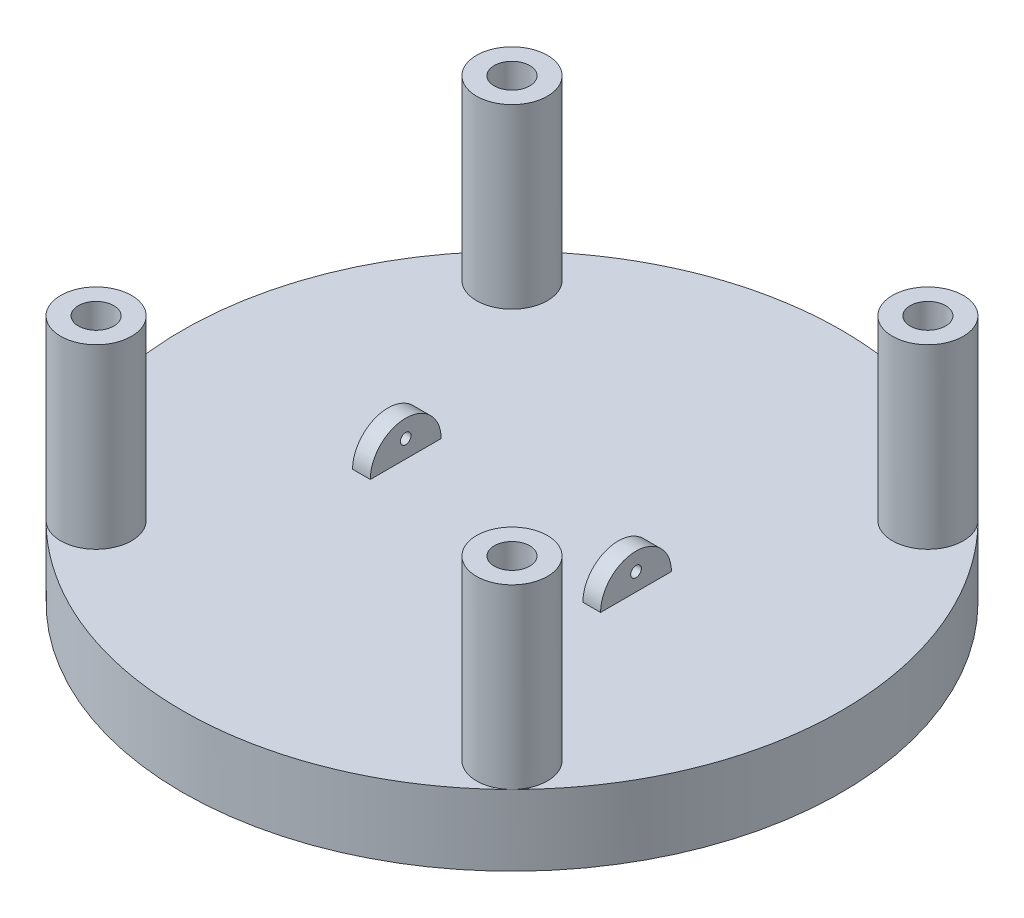
from build123d import *

# Parameters (mm, degrees)
SKETCH1_R           = 93
BOSS_EXTRUDE1_DEPTH = 20
SHELL1_T            = -3
SKETCH2_W           = 5
SKETCH2_H           = 10
REVOLVE1_ANGLE      = 180
SKETCH7_R           = 1.5
CUT_EXTRUDE1_DEPTH  = 10
SKETCH8_W           = 40
SKETCH8_H           = 40
CUT_EXTRUDE2_DEPTH  = 2
SKETCH9_R           = 10
BOSS_EXTRUDE2_DEPTH = 50
SKETCH10_R          = 5
CUT_EXTRUDE3_DEPTH  = 20
CIRPATTERN1_COUNT   = 4


with BuildPart() as part:
    # Sketch1 → Boss-Extrude1 (new body)
    with BuildSketch(Plane(origin=(0, 0, 0), x_dir=(1, 0, 0), z_dir=(0, 1, 0))):
        with Locations(Location((0, 0, 0), (0, 0, 270))):
            Circle(SKETCH1_R)
    extrude(amount=BOSS_EXTRUDE1_DEPTH)

    # Shell1
    shell1_openings = [part.faces().sort_by_distance(p)[0] for p in [
        (0, 0, 0),
    ]]
    offset(amount=SHELL1_T, openings=shell1_openings, kind=Kind.INTERSECTION)

    # Sketch2 → Revolve1 (revolve)
    with BuildSketch(Plane(origin=(0, 20, 0), x_dir=(1, 0, 0), z_dir=(0, 1, 0))):
        with Locations((-32.5, 5)):
            Rectangle(SKETCH2_W, SKETCH2_H)
    revolve1 = revolve(axis=Axis((0, 20, 0), (1, 0, 0)), revolution_arc=REVOLVE1_ANGLE)

    # Sketch7 → Cut-Extrude1 (cut)
    with BuildSketch(Plane.ZY.offset(35)):
        with Locations((0, 25)):
            Circle(SKETCH7_R)
    cut_extrude1 = extrude(amount=-CUT_EXTRUDE1_DEPTH, mode=Mode.SUBTRACT)

    # Mirror1: Revolve1, Cut-Extrude1 across plane
    add(revolve1.mirror(Plane(origin=(0, 0, 0), x_dir=(0, 0, 1), z_dir=(1, 0, 0))))
    add(cut_extrude1.mirror(Plane(origin=(0, 0, 0), x_dir=(0, 0, 1), z_dir=(1, 0, 0))), mode=Mode.SUBTRACT)

    # Sketch8 → Cut-Extrude2 (cut)
    with BuildSketch(Plane.XZ.offset(-17)):
        with Locations((0, 60)):
            Rectangle(SKETCH8_W, SKETCH8_H)
    cut_extrude2 = extrude(amount=-CUT_EXTRUDE2_DEPTH, mode=Mode.SUBTRACT)

    # Mirror2: Cut-Extrude2 across plane
    add(cut_extrude2.mirror(Plane.XY), mode=Mode.SUBTRACT)

    # Sketch9 → Boss-Extrude2 (add)
    with BuildSketch(Plane(origin=(0, 20, 0), x_dir=(1, 0, 0), z_dir=(0, 1, 0))):
        with Locations(Location((-58.689862838, 58.689862838, 0), (0, 0, 135))):
            Circle(SKETCH9_R)
    boss_extrude2 = extrude(amount=BOSS_EXTRUDE2_DEPTH)

    # Sketch10 → Cut-Extrude3 (cut)
    with BuildSketch(Plane(origin=(0, 70, 0), x_dir=(1, 0, 0), z_dir=(0, 1, 0))):
        with Locations(Location((-58.689862838, 58.689862838, 0), (0, 0, 270))):
            Circle(SKETCH10_R)
    cut_extrude3 = extrude(amount=-CUT_EXTRUDE3_DEPTH, mode=Mode.SUBTRACT)

    # CirPattern1: Boss-Extrude2, Cut-Extrude3 ×4 about axis
    cirpattern1_axis = Axis((0, 0, 0), (0, 1, 0))
    add([boss_extrude2.rotate(cirpattern1_axis, i * 360 / CIRPATTERN1_COUNT) for i in range(1, CIRPATTERN1_COUNT)])
    add([cut_extrude3.rotate(cirpattern1_axis, i * 360 / CIRPATTERN1_COUNT) for i in range(1, CIRPATTERN1_COUNT)], mode=Mode.SUBTRACT)


solid = part.part
